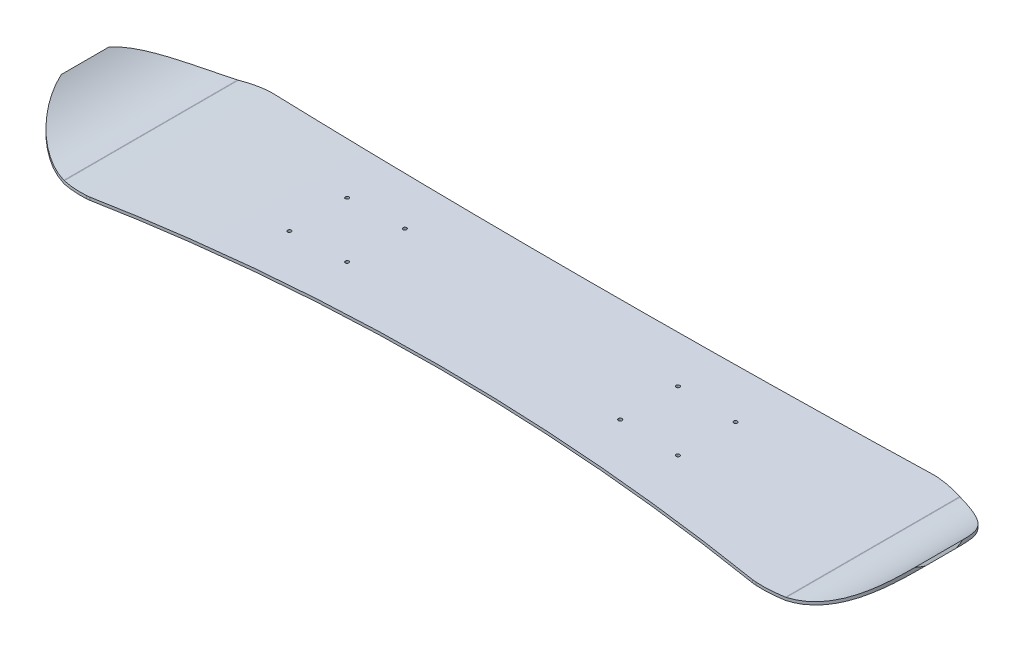
from build123d import *

# Parameters (mm, degrees)
SURFACE_EXTRUDE1_1_DEPTH = 320
THICKEN1_T2              = 5
CUT_EXTRUDE4_DEPTH       = 822.831905453
CUT_EXTRUDE4_DEPTH_BACK  = 822.831905453
SKETCH4_W                = 1766.449520351
SKETCH4_H                = 548.298402226
SKETCH5_R                = 3.175
CUT_EXTRUDE6_DEPTH       = 38.1


with BuildPart() as body_1:
    # Surface-Extrude1: a surface, the sketch's curves swept straight by 320 mm
    with BuildLine(Plane.XY, mode=Mode.PRIVATE) as surface_extrude1_1_path:
        ThreePointArc((-751.90793457, 48.09206543), (-698.887456572, 12.601985742), (-636.34204056, 0.000883438))
        ThreePointArc((-636.34204056, 0.000883438), (-635.814652298, 0.010107148), (-635.288101911, 0.041222188))
        ThreePointArc((-635.288101911, 0.041222188), (0, 25.4), (635.288101911, 0.041222188))
        ThreePointArc((635.288101911, 0.041222188), (635.814652298, 0.010107148), (636.34204056, 0.000883438))
        ThreePointArc((636.34204056, 0.000883438), (698.887456572, 12.601985742), (751.90793457, 48.09206543))
    surface_extrude1_1 = Shell.extrude(surface_extrude1_1_path.wire(), (0 * SURFACE_EXTRUDE1_1_DEPTH, 0 * SURFACE_EXTRUDE1_1_DEPTH, 1 * SURFACE_EXTRUDE1_1_DEPTH))
    add(Solid.thicken(surface_extrude1_1, -THICKEN1_T2))

    # Sketch4 → Cut-Extrude4 (cut, two sides: drawn at the far end of the back side and taken through both)
    with BuildSketch(Plane(origin=(0, 0, 0), x_dir=(1, 0, 0), z_dir=(0, 1, 0)).offset(-CUT_EXTRUDE4_DEPTH_BACK)):
        with Locations((45.804215296, -135.184013641)):
            Rectangle(SKETCH4_W, SKETCH4_H)
        with BuildLine():
            ThreePointArc((-583.566317069, -0.284102355), (0, -30), (583.566317069, -0.284102355))
            ThreePointArc((583.566317069, -0.284102355), (586.59717929, -0.065985036), (589.635660472, -0.029473734))
            add(Edge.make_bspline(
                [(589.635660472, -319.970526266), (757.943468476, -316.957964635), (757.943468476, -160), (757.943468476, -3.042035365), (589.635660472, -0.029473734)],
                knots=[4.731583589, 4.731583589, 4.731583589, 6.283185307, 6.283185307, 7.834787026, 7.834787026, 7.834787026], degree=2, weights=[1, 0.713860431, 1, 0.713860431, 1]))
            ThreePointArc((589.635660472, -319.970526266), (586.59717929, -319.934014964), (583.566317069, -319.715897645))
            ThreePointArc((583.566317069, -319.715897645), (0, -290), (-583.566317069, -319.715897645))
            ThreePointArc((-583.566317069, -319.715897645), (-586.59717929, -319.934014964), (-589.635660472, -319.970526266))
            add(Edge.make_bspline(
                [(-589.635660472, -0.029473734), (-757.943468476, -3.042035365), (-757.943468476, -160), (-757.943468476, -316.957964635), (-589.635660472, -319.970526266)],
                knots=[4.731583589, 4.731583589, 4.731583589, 6.283185307, 6.283185307, 7.834787026, 7.834787026, 7.834787026], degree=2, weights=[1, 0.713860431, 1, 0.713860431, 1]))
            ThreePointArc((-589.635660472, -0.029473734), (-586.59717929, -0.065985036), (-583.566317069, -0.284102355))
        make_face(mode=Mode.SUBTRACT)
    extrude(amount=CUT_EXTRUDE4_DEPTH + CUT_EXTRUDE4_DEPTH_BACK, mode=Mode.SUBTRACT)

    # Sketch5 → Cut-Extrude6 (cut)
    with BuildSketch(Plane(origin=(0, 0, 0), x_dir=(1, 0, 0), z_dir=(0, 1, 0))):
        with Locations(Location((-342.123166287, -108.266082566, 0), (0, 0, 90))):
            Circle(SKETCH5_R)
        with Locations(Location((-240.523166287, -108.266082566, 0), (0, 0, 90))):
            Circle(SKETCH5_R)
        with Locations(Location((-240.523166287, -209.866082566, 0), (0, 0, 90))):
            Circle(SKETCH5_R)
        with Locations(Location((-342.123166287, -209.866082566, 0), (0, 0, 90))):
            Circle(SKETCH5_R)
    cut_extrude6 = extrude(amount=CUT_EXTRUDE6_DEPTH, mode=Mode.SUBTRACT)

    # Mirror2: Cut-Extrude6 across plane
    add(cut_extrude6.mirror(Plane(origin=(0, 0, 0), x_dir=(0, 0, 1), z_dir=(1, 0, 0))), mode=Mode.SUBTRACT)


solid = body_1.part
